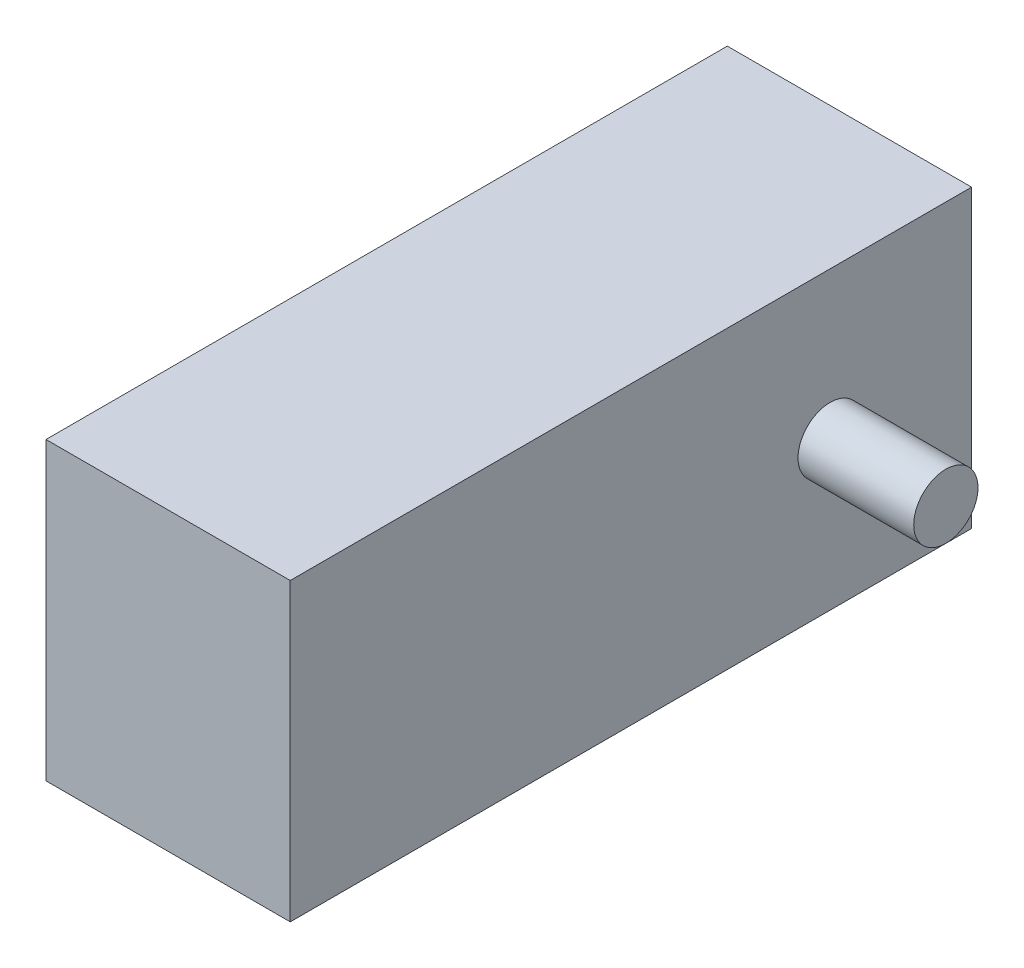
from build123d import *

# Parameters (mm, degrees)
SKETCH_2_W      = 53
SKETCH_2_H      = 23
EXTRUDE_1_DEPTH = 19
SKETCH_3_R      = 2.5
EXTRUDE_2_DEPTH = 9
EXTRUDE_START   = 9
SKETCH_7_R      = 2.5
EXTRUDE_5_DEPTH = 9


with BuildPart() as part:
    # 草图2 → 凸台-拉伸1 (new body)
    with BuildSketch(Plane(origin=(0, 0, 0), x_dir=(0, 0, -1), z_dir=(1, 0, 0))):
        with Locations((-9.248715633, 27.370444178)):
            Rectangle(SKETCH_2_W, SKETCH_2_H)
    extrude(amount=EXTRUDE_1_DEPTH)

    # 草图3 → 凸台-拉伸2 (add)
    with BuildSketch(Plane(origin=(19, 0, 0), x_dir=(0, 0, -1), z_dir=(1, 0, 0))):
        with Locations(Location((6.251284367, 27.370444178, 0), (0, 0, 180))):
            Circle(SKETCH_3_R)
    extrude(amount=EXTRUDE_2_DEPTH)

    # 草图7 → 凸台-拉伸5 (add)
    with BuildSketch(Plane.ZY.offset(EXTRUDE_START)):
        with Locations((-6.251284367, 27.370444178)):
            Circle(SKETCH_7_R)
    extrude(amount=-EXTRUDE_5_DEPTH)


solid = part.part
